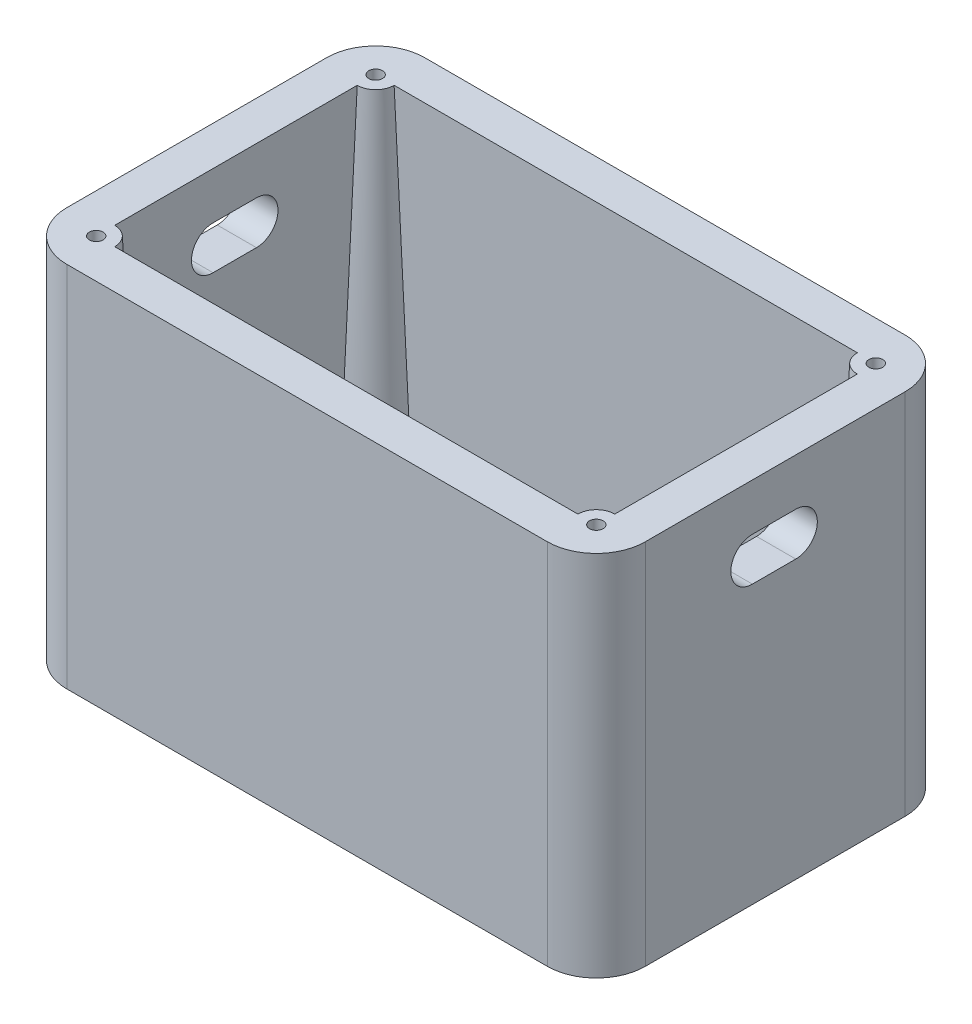
from build123d import *

# Parameters (mm, degrees)
SKETCH1_W                     = 118
SKETCH1_H                     = 73
BOSS_EXTRUDE1_DEPTH           = 75
SKETCH3_W                     = 102
SKETCH3_H                     = 57
CUT_EXTRUDE2_DEPTH            = 65
FILLET1_R                     = 10
CUT_EXTRUDE3_DEPTH            = 103.167754208
SKETCH5_R                     = 7.171572875
BOSS_EXTRUDE2_DEPTH           = 65
BOSS_EXTRUDE2_DRAFT           = 3
BOSS_EXTRUDE2_PROFILE_2_DEPTH = 65
BOSS_EXTRUDE2_PROFILE_2_DRAFT = 3
BOSS_EXTRUDE2_PROFILE_3_DEPTH = 65
BOSS_EXTRUDE2_PROFILE_3_DRAFT = 3
BOSS_EXTRUDE2_PROFILE_4_DEPTH = 65
BOSS_EXTRUDE2_PROFILE_4_DRAFT = 3
SKETCH9_R                     = 1.4
CUT_EXTRUDE6_DEPTH            = 5
CUT_EXTRUDE7_DEPTH            = 10000


with BuildPart() as part:
    # Sketch1 → Boss-Extrude1 (new body)
    with BuildSketch(Plane(origin=(0, 0, 0), x_dir=(1, 0, 0), z_dir=(0, 1, 0))):
        Rectangle(SKETCH1_W, SKETCH1_H)
    extrude(amount=BOSS_EXTRUDE1_DEPTH)

    # Sketch3 → Cut-Extrude2 (cut)
    with BuildSketch(Plane(origin=(0, 75, 0), x_dir=(1, 0, 0), z_dir=(0, 1, 0))):
        Rectangle(SKETCH3_W, SKETCH3_H)
    extrude(amount=-CUT_EXTRUDE2_DEPTH, mode=Mode.SUBTRACT)

    # Fillet1
    fillet1_edges = [part.edges().sort_by_distance(p)[0] for p in [
        (-59, 37.5, -36.5),
        (59, 37.5, -36.5),
        (59, 37.5, 36.5),
        (-59, 37.5, 36.5),
    ]]
    fillet(fillet1_edges, radius=FILLET1_R)

    # Sketch4 → Cut-Extrude3 (cut, through all)
    with BuildSketch(Plane.XZ):
        with BuildLine():
            Line((-44.5, -2.5), (-41.5, -2.5))
            ThreePointArc((-41.5, -2.5), (-39, 0), (-41.5, 2.5))
            Line((-41.5, 2.5), (-44.5, 2.5))
            ThreePointArc((-44.5, 2.5), (-47, 0), (-44.5, -2.5))
        make_face()
        with BuildLine():
            ThreePointArc((41.5, -2.5), (39, 0), (41.5, 2.5))
            Line((41.5, 2.5), (44.5, 2.5))
            ThreePointArc((44.5, 2.5), (47, 0), (44.5, -2.5))
            Line((44.5, -2.5), (41.5, -2.5))
        make_face()
    extrude(amount=-CUT_EXTRUDE3_DEPTH, mode=Mode.SUBTRACT)


with BuildPart() as boss_extrude2_tool:
    # Sketch5 → Boss-Extrude2 (with draft: the straight prism first)
    with BuildSketch(Plane(origin=(0, 10, 0), x_dir=(1, 0, 0), z_dir=(0, 1, 0))):
        with Locations((-51, 28.5)):
            Circle(SKETCH5_R)
    extrude(amount=BOSS_EXTRUDE2_DEPTH)
    # Boss-Extrude2: the draft: its side faces are tilted about the plane it starts from
    boss_extrude2_sides = [boss_extrude2_tool.faces().sort_by_distance(p)[0] for p in [
        (-58.171572875, 42.5, -28.5),
    ]]
    draft(boss_extrude2_sides, Plane(origin=(0, 10, 0), x_dir=(1, 0, 0), z_dir=(0, 1, 0)), BOSS_EXTRUDE2_DRAFT)


with BuildPart() as part_1:
    add(part.part)

    # Boss-Extrude2: add boss_extrude2_tool
    add(boss_extrude2_tool.part)


with BuildPart() as boss_extrude2_profile_2_tool:
    # Sketch5 → Boss-Extrude2 profile 2 (with draft: the straight prism first)
    with BuildSketch(Plane(origin=(0, 10, 0), x_dir=(1, 0, 0), z_dir=(0, 1, 0))):
        with Locations((51, 28.5)):
            Circle(SKETCH5_R)
    extrude(amount=BOSS_EXTRUDE2_PROFILE_2_DEPTH)
    # Boss-Extrude2 profile 2: the draft: its side faces are tilted about the plane it starts from
    boss_extrude2_profile_2_sides = [boss_extrude2_profile_2_tool.faces().sort_by_distance(p)[0] for p in [
        (43.828427125, 42.5, -28.5),
    ]]
    draft(boss_extrude2_profile_2_sides, Plane(origin=(0, 10, 0), x_dir=(1, 0, 0), z_dir=(0, 1, 0)), BOSS_EXTRUDE2_PROFILE_2_DRAFT)


with BuildPart() as part_2:
    add(part_1.part)

    # Boss-Extrude2 profile 2: add boss_extrude2_profile_2_tool
    add(boss_extrude2_profile_2_tool.part)


with BuildPart() as boss_extrude2_profile_3_tool:
    # Sketch5 → Boss-Extrude2 profile 3 (with draft: the straight prism first)
    with BuildSketch(Plane(origin=(0, 10, 0), x_dir=(1, 0, 0), z_dir=(0, 1, 0))):
        with Locations((51, -28.5)):
            Circle(SKETCH5_R)
    extrude(amount=BOSS_EXTRUDE2_PROFILE_3_DEPTH)
    # Boss-Extrude2 profile 3: the draft: its side faces are tilted about the plane it starts from
    boss_extrude2_profile_3_sides = [boss_extrude2_profile_3_tool.faces().sort_by_distance(p)[0] for p in [
        (43.828427125, 42.5, 28.5),
    ]]
    draft(boss_extrude2_profile_3_sides, Plane(origin=(0, 10, 0), x_dir=(1, 0, 0), z_dir=(0, 1, 0)), BOSS_EXTRUDE2_PROFILE_3_DRAFT)


with BuildPart() as part_3:
    add(part_2.part)

    # Boss-Extrude2 profile 3: add boss_extrude2_profile_3_tool
    add(boss_extrude2_profile_3_tool.part)


with BuildPart() as boss_extrude2_profile_4_tool:
    # Sketch5 → Boss-Extrude2 profile 4 (with draft: the straight prism first)
    with BuildSketch(Plane(origin=(0, 10, 0), x_dir=(1, 0, 0), z_dir=(0, 1, 0))):
        with Locations((-51, -28.5)):
            Circle(SKETCH5_R)
    extrude(amount=BOSS_EXTRUDE2_PROFILE_4_DEPTH)
    # Boss-Extrude2 profile 4: the draft: its side faces are tilted about the plane it starts from
    boss_extrude2_profile_4_sides = [boss_extrude2_profile_4_tool.faces().sort_by_distance(p)[0] for p in [
        (-58.171572875, 42.5, 28.5),
    ]]
    draft(boss_extrude2_profile_4_sides, Plane(origin=(0, 10, 0), x_dir=(1, 0, 0), z_dir=(0, 1, 0)), BOSS_EXTRUDE2_PROFILE_4_DRAFT)


with BuildPart() as part_4:
    add(part_3.part)

    # Boss-Extrude2 profile 4: add boss_extrude2_profile_4_tool
    add(boss_extrude2_profile_4_tool.part)

    # Sketch9 → Cut-Extrude6 (cut)
    with BuildSketch(Plane(origin=(0, 75, 0), x_dir=(1, 0, 0), z_dir=(0, 1, 0))):
        with Locations(Location((-51, 28.5, 0), (0, 0, 270))):
            Circle(SKETCH9_R)
        with Locations(Location((51, 28.5, 0), (0, 0, 90))):
            Circle(SKETCH9_R)
        with Locations(Location((51, -28.5, 0), (0, 0, 270))):
            Circle(SKETCH9_R)
        with Locations(Location((-51, -28.5, 0), (0, 0, 90))):
            Circle(SKETCH9_R)
    extrude(amount=-CUT_EXTRUDE6_DEPTH, mode=Mode.SUBTRACT)

    # Sketch13 → Cut-Extrude7 (cut)
    with BuildSketch(Plane.ZY.offset(59)):
        with BuildLine():
            Line((-4.178843904, 65.399928421), (4.670472599, 65.399928421))
            ThreePointArc((4.670472599, 65.399928421), (9.07040102, 61), (4.670472599, 56.600071579))
            Line((4.670472599, 56.600071579), (-4.178843904, 56.600071579))
            ThreePointArc((-4.178843904, 56.600071579), (-8.578772325, 61), (-4.178843904, 65.399928421))
        make_face()
    extrude(amount=-CUT_EXTRUDE7_DEPTH, mode=Mode.SUBTRACT)


solid = part_4.part
